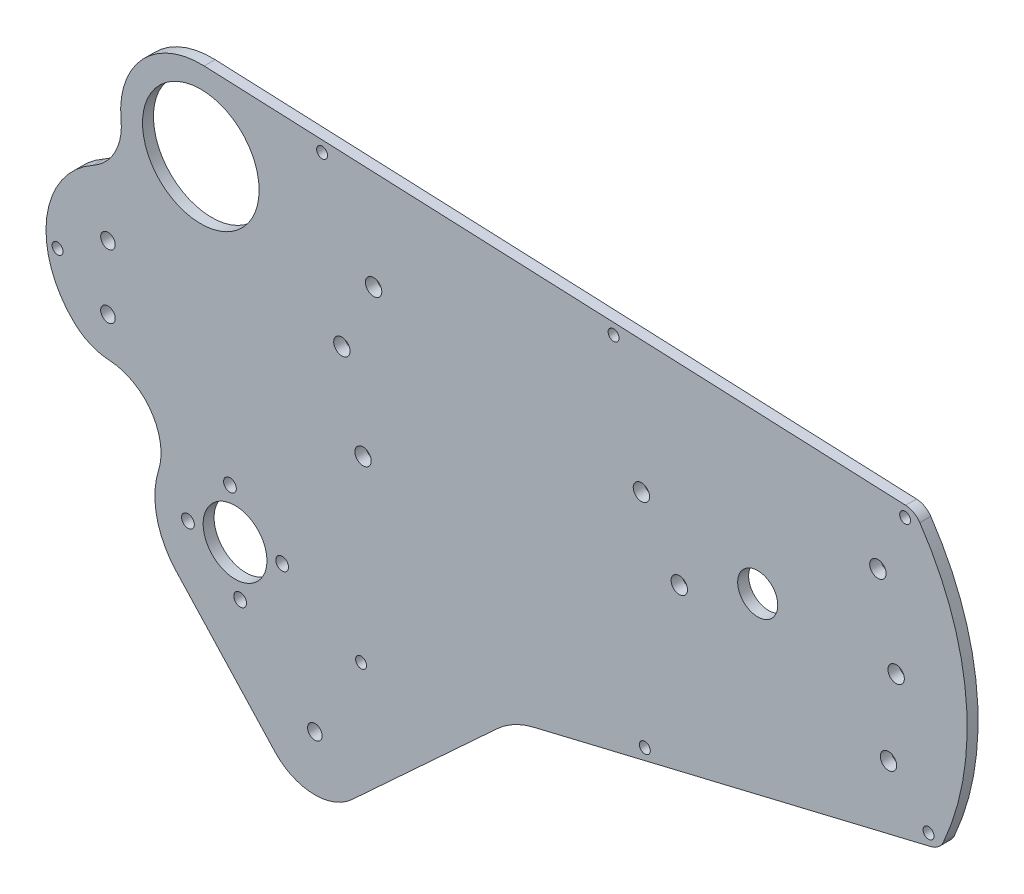
from build123d import *

# Parameters (mm, degrees)
SKETCH1_R           = 2
SKETCH1_R_2         = 2.25
SKETCH1_R_3         = 16
SKETCH1_R_4         = 5.5
SKETCH1_R_5         = 1.75
SKETCH1_R_6         = 8.75
BOSS_EXTRUDE1_DEPTH = 3
SKETCH2_R           = 1.5
CUT_EXTRUDE1_DEPTH  = 190.515777006


with BuildPart() as part:
    # Sketch1 → Boss-Extrude1 (new body)
    with BuildSketch(Plane.XY):
        with BuildLine():
            ThreePointArc((-111.886028634, 49.480245878), (-128.824449864, 42.592956949), (-134.705774542, 25.279526249))
            ThreePointArc((-134.705774542, 25.279526249), (-136.343375771, 16.802270376), (-142.382746132, 10.632050724))
            ThreePointArc((-142.382746132, 10.632050724), (-155.099864059, -8.058287742), (-147.542861296, -29.364285714))
            ThreePointArc((-147.542861296, -29.364285714), (-143.125485566, -32.280163581), (-137.970351553, -33.480224156))
            ThreePointArc((-137.970351553, -33.480224156), (-126.431132561, -39.888203569), (-124.422839539, -52.93360637))
            ThreePointArc((-124.422839539, -52.93360637), (-124.888175134, -64.31939994), (-119.594822483, -74.410646153))
            Line((-119.594822483, -74.410646153), (-92.540517723, -103.740413224))
            ThreePointArc((-92.540517723, -103.740413224), (-82.119700521, -108.557935129), (-71.344567605, -104.595807028))
            Line((-71.344567605, -104.595807028), (-31.441449774, -67.788453323))
            ThreePointArc((-31.441449774, -67.788453323), (-26.802171393, -64.493076397), (-21.481893225, -62.473904985))
            Line((-21.481893225, -62.473904985), (87.599861039, -36.324111832))
            ThreePointArc((87.599861039, -36.324111832), (89.628937626, -35.308169791), (91, -33.5))
            ThreePointArc((91, -33.5), (97.203558128, 3.661751943), (84.51565505, 39.137054004))
            ThreePointArc((84.51565505, 39.137054004), (82.813644384, 40.69192784), (80.594954641, 41.317938046))
            Line((80.594954641, 41.317938046), (-111.886028634, 49.480245878))
        make_face()
        with Locations((-81.514845762, -93.570135067)):
            Circle(SKETCH1_R, mode=Mode.SUBTRACT)
        with Locations((-138.3, -22.75)):
            Circle(SKETCH1_R, mode=Mode.SUBTRACT)
        with Locations((-138.3, -5.25)):
            Circle(SKETCH1_R, mode=Mode.SUBTRACT)
        with Locations((-68.3, -21.5)):
            Circle(SKETCH1_R_2, mode=Mode.SUBTRACT)
        with Locations((-74.1, 1.7)):
            Circle(SKETCH1_R_2, mode=Mode.SUBTRACT)
        with Locations((-112.818118288, 27.5)):
            Circle(SKETCH1_R_3, mode=Mode.SUBTRACT)
        with Locations((-65.4, 20.2)):
            Circle(SKETCH1_R_2, mode=Mode.SUBTRACT)
        with Locations((18.5, -8.7)):
            Circle(SKETCH1_R_2, mode=Mode.SUBTRACT)
        with Locations((8.1, 8.2)):
            Circle(SKETCH1_R_2, mode=Mode.SUBTRACT)
        with Locations((75.9, -21.8)):
            Circle(SKETCH1_R_2, mode=Mode.SUBTRACT)
        with Locations((40.017782272, 0)):
            Circle(SKETCH1_R_4, mode=Mode.SUBTRACT)
        with Locations((78, -0.1)):
            Circle(SKETCH1_R_2, mode=Mode.SUBTRACT)
        with Locations((73, 22.4)):
            Circle(SKETCH1_R_2, mode=Mode.SUBTRACT)
        with Locations((-90.498978695, -58.098516388)):
            Circle(SKETCH1_R_5, mode=Mode.SUBTRACT)
        with Locations((-102.02811514, -72.419096433)):
            Circle(SKETCH1_R_5, mode=Mode.SUBTRACT)
        with Locations((-116.348695186, -60.889959988)):
            Circle(SKETCH1_R_5, mode=Mode.SUBTRACT)
        with Locations((-103.42383694, -59.494238188)):
            Circle(SKETCH1_R_6, mode=Mode.SUBTRACT)
        with Locations((-104.819558741, -46.569379943)):
            Circle(SKETCH1_R_5, mode=Mode.SUBTRACT)
    extrude(amount=BOSS_EXTRUDE1_DEPTH)

    # Sketch2 → Cut-Extrude1 (cut, through all)
    with BuildSketch(Plane.XY.offset(3)):
        with Locations((80.467851506, 38.32063179)):
            Circle(SKETCH2_R)
        with Locations((0.467851506, 41.713094856)):
            Circle(SKETCH2_R)
        with Locations((-79.532148494, 45.105557921)):
            Circle(SKETCH2_R)
        with Locations((86.900496491, -33.406768995)):
            Circle(SKETCH2_R)
        with Locations((9.034770729, -52.073251177)):
            Circle(SKETCH2_R)
        with Locations((-152.133709173, -14)):
            Circle(SKETCH2_R)
        with Locations((-68.830955034, -70.73973336)):
            Circle(SKETCH2_R)
    extrude(amount=-CUT_EXTRUDE1_DEPTH, mode=Mode.SUBTRACT)


solid = part.part
